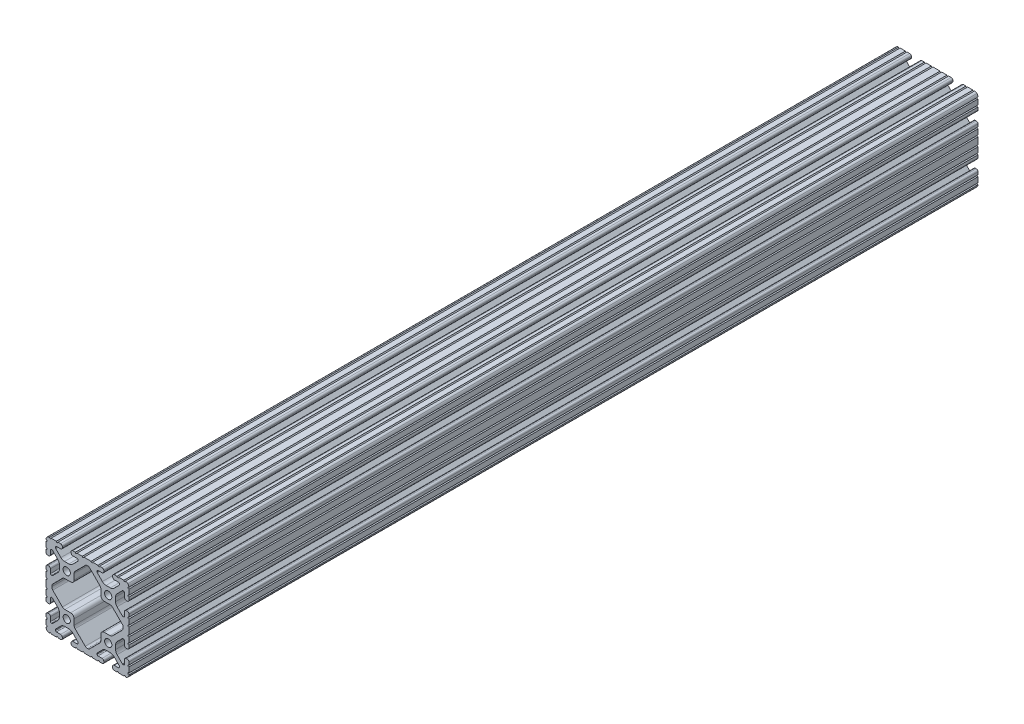
from build123d import *

# Parameters (mm, degrees)
BOSS_EXTRUDE1_DEPTH      = 390
BOSS_EXTRUDE1_DEPTH_BACK = 390
SKETCH3_R                = 3.3274


with BuildPart() as part:
    # Sketch3 → Boss-Extrude1 (new, two sides: drawn at the far end of the back side and taken through both)
    with BuildSketch(Plane.XY.offset(-BOSS_EXTRUDE1_DEPTH_BACK)):
        with BuildLine():
            Line((34.036, 28.448), (34.036, 24.630196049))
            ThreePointArc((34.036, 24.630196049), (34.497248241, 23.51664429), (35.6108, 23.055396049))
            Line((35.6108, 23.055396049), (36.525200183, 23.055396049))
            ThreePointArc((36.525200183, 23.055396049), (37.638751813, 23.516644236), (38.1, 24.630195866))
            Line((38.1, 24.630195866), (38.1, 27.023826138))
            ThreePointArc((38.1, 27.023826138), (37.117780706, 27.7845421), (38.1, 28.545258062))
            Line((38.1, 28.545258062), (38.1, 33.373016026))
            ThreePointArc((38.1, 33.373016026), (37.141472621, 34.109236774), (38.1, 34.845457521))
            ThreePointArc((38.1, 34.845457521), (37.837757813, 36.120195002), (37.086123144, 37.182631793))
            ThreePointArc((37.086123144, 37.182631793), (36.106286572, 37.843374398), (34.952681874, 38.1))
            ThreePointArc((34.952681874, 38.1), (34.190730434, 37.320215335), (33.428778994, 38.1))
            Line((33.428778994, 38.1), (28.601105935, 38.1))
            ThreePointArc((28.601105935, 38.1), (27.839158581, 37.32021942), (27.077211227, 38.1))
            Line((27.077211227, 38.1), (24.6888, 38.1))
            ThreePointArc((24.6888, 38.1), (23.575248241, 37.638751759), (23.114, 36.5252))
            Line((23.114, 36.5252), (23.114, 35.6108))
            ThreePointArc((23.114, 35.6108), (23.575248241, 34.497248241), (24.6888, 34.036))
            Line((24.6888, 34.036), (28.448, 34.036))
            ThreePointArc((28.448, 34.036), (29.076617928, 33.775617928), (29.337, 33.147))
            Line((29.337, 33.147), (29.337, 32.720693454))
            ThreePointArc((29.337, 32.720693454), (29.326675076, 32.273872751), (29.100231244, 31.888543625))
            Line((29.100231244, 31.888543625), (24.409287499, 27.197588341))
            ThreePointArc((24.409287499, 27.197588341), (22.868340045, 26.167958114), (21.050667579, 25.8064))
            Line((21.050667579, 25.8064), (17.049332421, 25.8064))
            ThreePointArc((17.049332421, 25.8064), (15.231659955, 26.167958114), (13.690712501, 27.197588341))
            Line((13.690712501, 27.197588341), (9.023381298, 31.864931024))
            ThreePointArc((9.023381298, 31.864931024), (8.830670886, 32.153343113), (8.763, 32.493548179))
            Line((8.763, 32.493548179), (8.763, 33.147))
            ThreePointArc((8.763, 33.147), (9.023382072, 33.775617928), (9.652, 34.036))
            Line((9.652, 34.036), (13.4112, 34.036))
            ThreePointArc((13.4112, 34.036), (14.524751759, 34.497248241), (14.986, 35.6108))
            Line((14.986, 35.6108), (14.986, 36.5252))
            ThreePointArc((14.986, 36.5252), (14.524751759, 37.638751759), (13.4112, 38.1))
            Line((13.4112, 38.1), (11.128867074, 38.1))
            ThreePointArc((11.128867074, 38.1), (10.367071033, 37.320370693), (9.605274992, 38.1))
            Line((9.605274992, 38.1), (4.777313069, 38.1))
            ThreePointArc((4.777313069, 38.1), (4.015517029, 37.320370693), (3.253720988, 38.1))
            Line((3.253720988, 38.1), (-3.253720988, 38.1))
            ThreePointArc((-3.253720988, 38.1), (-4.015517029, 37.320370693), (-4.777313069, 38.1))
            Line((-4.777313069, 38.1), (-9.605274992, 38.1))
            ThreePointArc((-9.605274992, 38.1), (-10.367071033, 37.320370693), (-11.128867074, 38.1))
            Line((-11.128867074, 38.1), (-13.4112, 38.1))
            ThreePointArc((-13.4112, 38.1), (-14.524751759, 37.638751759), (-14.986, 36.5252))
            Line((-14.986, 36.5252), (-14.986, 35.6108))
            ThreePointArc((-14.986, 35.6108), (-14.524751759, 34.497248241), (-13.4112, 34.036))
            Line((-13.4112, 34.036), (-9.652, 34.036))
            ThreePointArc((-9.652, 34.036), (-9.023382072, 33.775617928), (-8.763, 33.147))
            Line((-8.763, 33.147), (-8.763, 32.493548179))
            ThreePointArc((-8.763, 32.493548179), (-8.830670886, 32.153343113), (-9.023381298, 31.864931024))
            Line((-9.023381298, 31.864931024), (-13.690712501, 27.197588341))
            ThreePointArc((-13.690712501, 27.197588341), (-15.231659955, 26.167958114), (-17.049332421, 25.8064))
            Line((-17.049332421, 25.8064), (-21.050667579, 25.8064))
            ThreePointArc((-21.050667579, 25.8064), (-22.868340045, 26.167958114), (-24.409287499, 27.197588341))
            Line((-24.409287499, 27.197588341), (-29.100231244, 31.888543625))
            ThreePointArc((-29.100231244, 31.888543625), (-29.326675076, 32.273872751), (-29.337, 32.720693454))
            Line((-29.337, 32.720693454), (-29.337, 33.147))
            ThreePointArc((-29.337, 33.147), (-29.076617928, 33.775617928), (-28.448, 34.036))
            Line((-28.448, 34.036), (-24.6888, 34.036))
            ThreePointArc((-24.6888, 34.036), (-23.575248241, 34.497248241), (-23.114, 35.6108))
            Line((-23.114, 35.6108), (-23.114, 36.5252))
            ThreePointArc((-23.114, 36.5252), (-23.575248241, 37.638751759), (-24.6888, 38.1))
            Line((-24.6888, 38.1), (-27.077211227, 38.1))
            ThreePointArc((-27.077211227, 38.1), (-27.839158581, 37.32021942), (-28.601105935, 38.1))
            Line((-28.601105935, 38.1), (-33.428778994, 38.1))
            ThreePointArc((-33.428778994, 38.1), (-34.190730434, 37.320215335), (-34.952681874, 38.1))
            ThreePointArc((-34.952681874, 38.1), (-36.106286572, 37.843374398), (-37.086123144, 37.182631793))
            ThreePointArc((-37.086123144, 37.182631793), (-37.837757813, 36.120195002), (-38.1, 34.845457521))
            ThreePointArc((-38.1, 34.845457521), (-37.141472621, 34.109236774), (-38.1, 33.373016026))
            Line((-38.1, 33.373016026), (-38.1, 28.545258062))
            ThreePointArc((-38.1, 28.545258062), (-37.117780706, 27.7845421), (-38.1, 27.023826138))
            Line((-38.1, 27.023826138), (-38.1, 24.630195866))
            ThreePointArc((-38.1, 24.630195866), (-37.638751813, 23.516644236), (-36.525200183, 23.055396049))
            Line((-36.525200183, 23.055396049), (-35.6108, 23.055396049))
            ThreePointArc((-35.6108, 23.055396049), (-34.497248241, 23.51664429), (-34.036, 24.630196049))
            Line((-34.036, 24.630196049), (-34.036, 28.448))
            ThreePointArc((-34.036, 28.448), (-33.775617928, 29.076617928), (-33.147, 29.337))
            Line((-33.147, 29.337), (-32.664287242, 29.337))
            ThreePointArc((-32.664287242, 29.337), (-32.324081166, 29.269328695), (-32.03566854, 29.076617155))
            Line((-32.03566854, 29.076617155), (-27.19758008, 24.238516795))
            ThreePointArc((-27.19758008, 24.238516795), (-26.167955879, 22.697572205), (-25.8064, 20.879905136))
            Line((-25.8064, 20.879905136), (-25.8064, 17.220094864))
            ThreePointArc((-25.8064, 17.220094864), (-26.167955879, 15.402427795), (-27.19758008, 13.861483205))
            Line((-27.19758008, 13.861483205), (-31.948944541, 9.110107057))
            ThreePointArc((-31.948944541, 9.110107057), (-32.333417096, 8.853210196), (-32.786933649, 8.763))
            Line((-32.786933649, 8.763), (-33.060275787, 8.763))
            ThreePointArc((-33.060275787, 8.763), (-33.750216995, 9.048783005), (-34.036, 9.738724213))
            Line((-34.036, 9.738724213), (-34.036, 13.469803585))
            ThreePointArc((-34.036, 13.469803585), (-34.497248348, 14.583355603), (-35.610800366, 15.044603951))
            Line((-35.610800366, 15.044603951), (-36.5252, 15.044603951))
            ThreePointArc((-36.5252, 15.044603951), (-37.638751759, 14.58335571), (-38.1, 13.469803951))
            Line((-38.1, 13.469803951), (-38.1, 11.075039289))
            ThreePointArc((-38.1, 11.075039289), (-37.117000248, 10.313517272), (-38.1, 9.551995255))
            Line((-38.1, 9.551995255), (-38.1, 4.723759308))
            ThreePointArc((-38.1, 4.723759308), (-37.117000248, 3.962237292), (-38.1, 3.200715275))
            Line((-38.1, 3.200715275), (-38.1, -3.200715275))
            ThreePointArc((-38.1, -3.200715275), (-37.117000248, -3.962237292), (-38.1, -4.723759308))
            Line((-38.1, -4.723759308), (-38.1, -9.551995255))
            ThreePointArc((-38.1, -9.551995255), (-37.117000248, -10.313517272), (-38.1, -11.075039289))
            Line((-38.1, -11.075039289), (-38.1, -13.469803951))
            ThreePointArc((-38.1, -13.469803951), (-37.638751759, -14.58335571), (-36.5252, -15.044603951))
            Line((-36.5252, -15.044603951), (-35.610800366, -15.044603951))
            ThreePointArc((-35.610800366, -15.044603951), (-34.497248348, -14.583355603), (-34.036, -13.469803585))
            Line((-34.036, -13.469803585), (-34.036, -9.738724213))
            ThreePointArc((-34.036, -9.738724213), (-33.750216995, -9.048783005), (-33.060275787, -8.763))
            Line((-33.060275787, -8.763), (-32.786933649, -8.763))
            ThreePointArc((-32.786933649, -8.763), (-32.333417096, -8.853210196), (-31.948944541, -9.110107057))
            Line((-31.948944541, -9.110107057), (-27.19758008, -13.861483205))
            ThreePointArc((-27.19758008, -13.861483205), (-26.167955879, -15.402427795), (-25.8064, -17.220094864))
            Line((-25.8064, -17.220094864), (-25.8064, -20.879905136))
            ThreePointArc((-25.8064, -20.879905136), (-26.167955879, -22.697572205), (-27.19758008, -24.238516795))
            Line((-27.19758008, -24.238516795), (-32.03566854, -29.076617155))
            ThreePointArc((-32.03566854, -29.076617155), (-32.324081166, -29.269328695), (-32.664287242, -29.337))
            Line((-32.664287242, -29.337), (-33.147, -29.337))
            ThreePointArc((-33.147, -29.337), (-33.775617928, -29.076617928), (-34.036, -28.448))
            Line((-34.036, -28.448), (-34.036, -24.630196049))
            ThreePointArc((-34.036, -24.630196049), (-34.497248241, -23.51664429), (-35.6108, -23.055396049))
            Line((-35.6108, -23.055396049), (-36.525200183, -23.055396049))
            ThreePointArc((-36.525200183, -23.055396049), (-37.638751813, -23.516644236), (-38.1, -24.630195866))
            Line((-38.1, -24.630195866), (-38.1, -27.023826138))
            ThreePointArc((-38.1, -27.023826138), (-37.117780706, -27.7845421), (-38.1, -28.545258062))
            Line((-38.1, -28.545258062), (-38.1, -33.373016026))
            ThreePointArc((-38.1, -33.373016026), (-37.141472621, -34.109236774), (-38.1, -34.845457521))
            ThreePointArc((-38.1, -34.845457521), (-37.837757813, -36.120195002), (-37.086123144, -37.182631793))
            ThreePointArc((-37.086123144, -37.182631793), (-36.106286572, -37.843374398), (-34.952681874, -38.1))
            ThreePointArc((-34.952681874, -38.1), (-34.190730434, -37.320215335), (-33.428778994, -38.1))
            Line((-33.428778994, -38.1), (-28.601105935, -38.1))
            ThreePointArc((-28.601105935, -38.1), (-27.839158581, -37.32021942), (-27.077211227, -38.1))
            Line((-27.077211227, -38.1), (-24.6888, -38.1))
            ThreePointArc((-24.6888, -38.1), (-23.575248241, -37.638751759), (-23.114, -36.5252))
            Line((-23.114, -36.5252), (-23.114, -35.6108))
            ThreePointArc((-23.114, -35.6108), (-23.575248241, -34.497248241), (-24.6888, -34.036))
            Line((-24.6888, -34.036), (-28.448, -34.036))
            ThreePointArc((-28.448, -34.036), (-29.076617928, -33.775617928), (-29.337, -33.147))
            Line((-29.337, -33.147), (-29.337, -32.720693454))
            ThreePointArc((-29.337, -32.720693454), (-29.326675076, -32.273872751), (-29.100231244, -31.888543625))
            Line((-29.100231244, -31.888543625), (-24.409287499, -27.197588341))
            ThreePointArc((-24.409287499, -27.197588341), (-22.868340045, -26.167958114), (-21.050667579, -25.8064))
            Line((-21.050667579, -25.8064), (-17.049332421, -25.8064))
            ThreePointArc((-17.049332421, -25.8064), (-15.231659955, -26.167958114), (-13.690712501, -27.197588341))
            Line((-13.690712501, -27.197588341), (-9.023381298, -31.864931024))
            ThreePointArc((-9.023381298, -31.864931024), (-8.830670886, -32.153343113), (-8.763, -32.493548179))
            Line((-8.763, -32.493548179), (-8.763, -33.147))
            ThreePointArc((-8.763, -33.147), (-9.023382072, -33.775617928), (-9.652, -34.036))
            Line((-9.652, -34.036), (-13.4112, -34.036))
            ThreePointArc((-13.4112, -34.036), (-14.524751759, -34.497248241), (-14.986, -35.6108))
            Line((-14.986, -35.6108), (-14.986, -36.5252))
            ThreePointArc((-14.986, -36.5252), (-14.524751759, -37.638751759), (-13.4112, -38.1))
            Line((-13.4112, -38.1), (-11.128867074, -38.1))
            ThreePointArc((-11.128867074, -38.1), (-10.367071033, -37.320370693), (-9.605274992, -38.1))
            Line((-9.605274992, -38.1), (-4.777313069, -38.1))
            ThreePointArc((-4.777313069, -38.1), (-4.015517029, -37.320370693), (-3.253720988, -38.1))
            Line((-3.253720988, -38.1), (3.253720988, -38.1))
            ThreePointArc((3.253720988, -38.1), (4.015517029, -37.320370693), (4.777313069, -38.1))
            Line((4.777313069, -38.1), (9.605274992, -38.1))
            ThreePointArc((9.605274992, -38.1), (10.367071033, -37.320370693), (11.128867074, -38.1))
            Line((11.128867074, -38.1), (13.4112, -38.1))
            ThreePointArc((13.4112, -38.1), (14.524751759, -37.638751759), (14.986, -36.5252))
            Line((14.986, -36.5252), (14.986, -35.6108))
            ThreePointArc((14.986, -35.6108), (14.524751759, -34.497248241), (13.4112, -34.036))
            Line((13.4112, -34.036), (9.652, -34.036))
            ThreePointArc((9.652, -34.036), (9.023382072, -33.775617928), (8.763, -33.147))
            Line((8.763, -33.147), (8.763, -32.493548179))
            ThreePointArc((8.763, -32.493548179), (8.830670886, -32.153343113), (9.023381298, -31.864931024))
            Line((9.023381298, -31.864931024), (13.690712501, -27.197588341))
            ThreePointArc((13.690712501, -27.197588341), (15.231659955, -26.167958114), (17.049332421, -25.8064))
            Line((17.049332421, -25.8064), (21.050667579, -25.8064))
            ThreePointArc((21.050667579, -25.8064), (22.868340045, -26.167958114), (24.409287499, -27.197588341))
            Line((24.409287499, -27.197588341), (29.100231244, -31.888543625))
            ThreePointArc((29.100231244, -31.888543625), (29.326675076, -32.273872751), (29.337, -32.720693454))
            Line((29.337, -32.720693454), (29.337, -33.147))
            ThreePointArc((29.337, -33.147), (29.076617928, -33.775617928), (28.448, -34.036))
            Line((28.448, -34.036), (24.6888, -34.036))
            ThreePointArc((24.6888, -34.036), (23.575248241, -34.497248241), (23.114, -35.6108))
            Line((23.114, -35.6108), (23.114, -36.5252))
            ThreePointArc((23.114, -36.5252), (23.575248241, -37.638751759), (24.6888, -38.1))
            Line((24.6888, -38.1), (27.077211227, -38.1))
            ThreePointArc((27.077211227, -38.1), (27.839158581, -37.32021942), (28.601105935, -38.1))
            Line((28.601105935, -38.1), (33.428778994, -38.1))
            ThreePointArc((33.428778994, -38.1), (34.190730434, -37.320215335), (34.952681874, -38.1))
            ThreePointArc((34.952681874, -38.1), (36.106286572, -37.843374398), (37.086123144, -37.182631793))
            ThreePointArc((37.086123144, -37.182631793), (37.837757813, -36.120195002), (38.1, -34.845457521))
            ThreePointArc((38.1, -34.845457521), (37.141472621, -34.109236774), (38.1, -33.373016026))
            Line((38.1, -33.373016026), (38.1, -28.545258062))
            ThreePointArc((38.1, -28.545258062), (37.117780706, -27.7845421), (38.1, -27.023826138))
            Line((38.1, -27.023826138), (38.1, -24.630195866))
            ThreePointArc((38.1, -24.630195866), (37.638751813, -23.516644236), (36.525200183, -23.055396049))
            Line((36.525200183, -23.055396049), (35.6108, -23.055396049))
            ThreePointArc((35.6108, -23.055396049), (34.497248241, -23.51664429), (34.036, -24.630196049))
            Line((34.036, -24.630196049), (34.036, -28.448))
            ThreePointArc((34.036, -28.448), (33.775617928, -29.076617928), (33.147, -29.337))
            Line((33.147, -29.337), (32.664287242, -29.337))
            ThreePointArc((32.664287242, -29.337), (32.324081166, -29.269328695), (32.03566854, -29.076617155))
            Line((32.03566854, -29.076617155), (27.19758008, -24.238516795))
            ThreePointArc((27.19758008, -24.238516795), (26.167955879, -22.697572205), (25.8064, -20.879905136))
            Line((25.8064, -20.879905136), (25.8064, -17.220094864))
            ThreePointArc((25.8064, -17.220094864), (26.167955879, -15.402427795), (27.19758008, -13.861483205))
            Line((27.19758008, -13.861483205), (31.948944541, -9.110107057))
            ThreePointArc((31.948944541, -9.110107057), (32.333417096, -8.853210196), (32.786933649, -8.763))
            Line((32.786933649, -8.763), (33.060275787, -8.763))
            ThreePointArc((33.060275787, -8.763), (33.750216995, -9.048783005), (34.036, -9.738724213))
            Line((34.036, -9.738724213), (34.036, -13.469803585))
            ThreePointArc((34.036, -13.469803585), (34.497248348, -14.583355603), (35.610800366, -15.044603951))
            Line((35.610800366, -15.044603951), (36.5252, -15.044603951))
            ThreePointArc((36.5252, -15.044603951), (37.638751759, -14.58335571), (38.1, -13.469803951))
            Line((38.1, -13.469803951), (38.1, -11.075039289))
            ThreePointArc((38.1, -11.075039289), (37.117000248, -10.313517272), (38.1, -9.551995255))
            Line((38.1, -9.551995255), (38.1, -4.723759308))
            ThreePointArc((38.1, -4.723759308), (37.117000248, -3.962237292), (38.1, -3.200715275))
            Line((38.1, -3.200715275), (38.1, 3.200715275))
            ThreePointArc((38.1, 3.200715275), (37.117000248, 3.962237292), (38.1, 4.723759308))
            Line((38.1, 4.723759308), (38.1, 9.551995255))
            ThreePointArc((38.1, 9.551995255), (37.117000248, 10.313517272), (38.1, 11.075039289))
            Line((38.1, 11.075039289), (38.1, 13.469803951))
            ThreePointArc((38.1, 13.469803951), (37.638751759, 14.58335571), (36.5252, 15.044603951))
            Line((36.5252, 15.044603951), (35.610800366, 15.044603951))
            ThreePointArc((35.610800366, 15.044603951), (34.497248348, 14.583355603), (34.036, 13.469803585))
            Line((34.036, 13.469803585), (34.036, 9.738724213))
            ThreePointArc((34.036, 9.738724213), (33.750216995, 9.048783005), (33.060275787, 8.763))
            Line((33.060275787, 8.763), (32.786933649, 8.763))
            ThreePointArc((32.786933649, 8.763), (32.333417096, 8.853210196), (31.948944541, 9.110107057))
            Line((31.948944541, 9.110107057), (27.19758008, 13.861483205))
            ThreePointArc((27.19758008, 13.861483205), (26.167955879, 15.402427795), (25.8064, 17.220094864))
            Line((25.8064, 17.220094864), (25.8064, 20.879905136))
            ThreePointArc((25.8064, 20.879905136), (26.167955879, 22.697572205), (27.19758008, 24.238516795))
            Line((27.19758008, 24.238516795), (32.03566854, 29.076617155))
            ThreePointArc((32.03566854, 29.076617155), (32.324081166, 29.269328695), (32.664287242, 29.337))
            Line((32.664287242, 29.337), (33.147, 29.337))
            ThreePointArc((33.147, 29.337), (33.775617928, 29.076617928), (34.036, 28.448))
        make_face()
        with Locations((19.05, 19.05)):
            Circle(SKETCH3_R, mode=Mode.SUBTRACT)
        with Locations((-19.05, 19.05)):
            Circle(SKETCH3_R, mode=Mode.SUBTRACT)
        with Locations((19.05, -19.05)):
            Circle(SKETCH3_R, mode=Mode.SUBTRACT)
        with Locations((-19.05, -19.05)):
            Circle(SKETCH3_R, mode=Mode.SUBTRACT)
        with BuildLine():
            Line((-11.363666791, -22.843321003), (-2.051515952, -32.155494748))
            ThreePointArc((-2.051515952, -32.155494748), (-1.11031328, -32.786013752), (0, -33.011005091))
            ThreePointArc((0, -33.011005091), (1.11031328, -32.786013752), (2.051515952, -32.155494748))
            Line((2.051515952, -32.155494748), (11.363666791, -22.843321003))
            ThreePointArc((11.363666791, -22.843321003), (12.051918263, -21.813277828), (12.2936, -20.598259734))
            Line((12.2936, -20.598259734), (12.2936, -15.4686))
            ThreePointArc((12.2936, -15.4686), (13.22353597, -13.22353597), (15.4686, -12.2936))
            Line((15.4686, -12.2936), (20.769026744, -12.2936))
            ThreePointArc((20.769026744, -12.2936), (21.984048446, -12.051916769), (23.014093535, -11.363661269))
            Line((23.014093535, -11.363661269), (31.902125566, -2.475607377))
            ThreePointArc((31.902125566, -2.475607377), (32.607298578, -1.335259481), (32.728725173, 0))
            ThreePointArc((32.728725173, 0), (32.607298578, 1.335259481), (31.902125566, 2.475607377))
            Line((31.902125566, 2.475607377), (23.014093535, 11.363661269))
            ThreePointArc((23.014093535, 11.363661269), (21.984048446, 12.051916769), (20.769026744, 12.2936))
            Line((20.769026744, 12.2936), (15.4686, 12.2936))
            ThreePointArc((15.4686, 12.2936), (13.22353597, 13.22353597), (12.2936, 15.4686))
            Line((12.2936, 15.4686), (12.2936, 20.598259734))
            ThreePointArc((12.2936, 20.598259734), (12.051918263, 21.813277828), (11.363666791, 22.843321003))
            Line((11.363666791, 22.843321003), (2.051515952, 32.155494748))
            ThreePointArc((2.051515952, 32.155494748), (1.11031328, 32.786013752), (0, 33.011005091))
            ThreePointArc((0, 33.011005091), (-1.11031328, 32.786013752), (-2.051515952, 32.155494748))
            Line((-2.051515952, 32.155494748), (-11.363666791, 22.843321003))
            ThreePointArc((-11.363666791, 22.843321003), (-12.051918263, 21.813277828), (-12.2936, 20.598259734))
            Line((-12.2936, 20.598259734), (-12.2936, 15.4686))
            ThreePointArc((-12.2936, 15.4686), (-13.22353597, 13.22353597), (-15.4686, 12.2936))
            Line((-15.4686, 12.2936), (-20.769026744, 12.2936))
            ThreePointArc((-20.769026744, 12.2936), (-21.984048446, 12.051916769), (-23.014093535, 11.363661269))
            Line((-23.014093535, 11.363661269), (-31.902125566, 2.475607377))
            ThreePointArc((-31.902125566, 2.475607377), (-32.607298578, 1.335259481), (-32.728725173, 0))
            ThreePointArc((-32.728725173, 0), (-32.607298578, -1.335259481), (-31.902125566, -2.475607377))
            Line((-31.902125566, -2.475607377), (-23.014093535, -11.363661269))
            ThreePointArc((-23.014093535, -11.363661269), (-21.984048446, -12.051916769), (-20.769026744, -12.2936))
            Line((-20.769026744, -12.2936), (-15.4686, -12.2936))
            ThreePointArc((-15.4686, -12.2936), (-13.22353597, -13.22353597), (-12.2936, -15.4686))
            Line((-12.2936, -15.4686), (-12.2936, -20.598259734))
            ThreePointArc((-12.2936, -20.598259734), (-12.051918263, -21.813277828), (-11.363666791, -22.843321003))
        make_face(mode=Mode.SUBTRACT)
    extrude(amount=BOSS_EXTRUDE1_DEPTH + BOSS_EXTRUDE1_DEPTH_BACK)


solid = part.part
